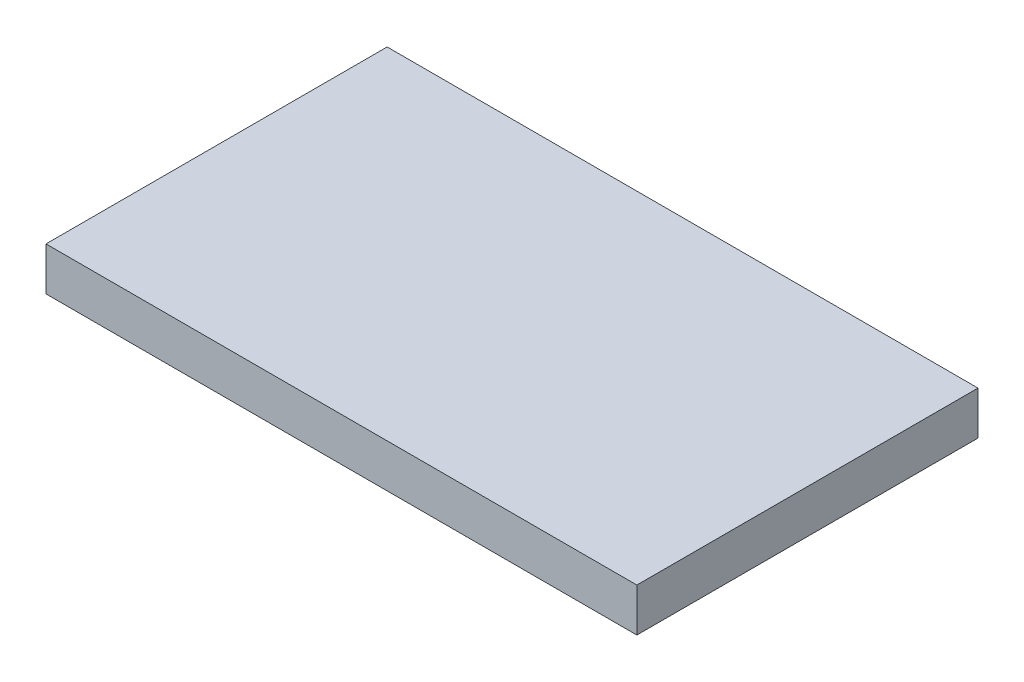
from build123d import *

# Parameters (mm, degrees)
ESQUISSE2_W        = 86.602540378
ESQUISSE2_H        = 50
BOSS_EXTRU_1_DEPTH = 6.35


with BuildPart() as part:
    # Esquisse2 → Boss.-Extru.1 (new body)
    with BuildSketch(Plane(origin=(0, 0, 0), x_dir=(1, 0, 0), z_dir=(0, 1, 0))):
        Rectangle(ESQUISSE2_W, ESQUISSE2_H)
    extrude(amount=BOSS_EXTRU_1_DEPTH)


solid = part.part
